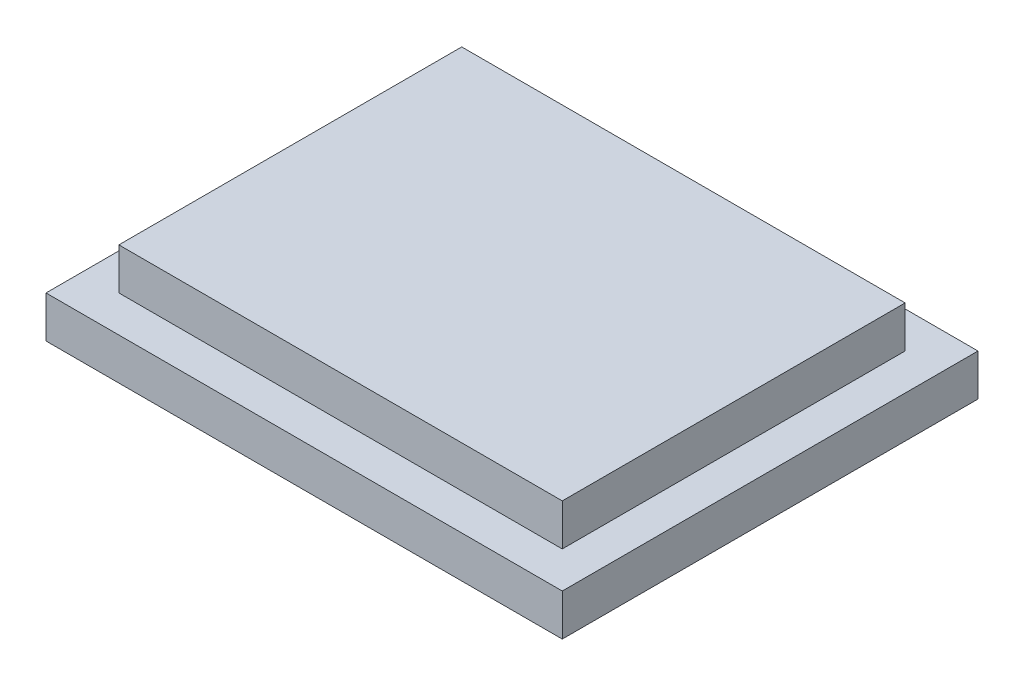
from build123d import *

# Parameters (mm, degrees)
SKETCH1_W           = 24.8
SKETCH1_H           = 19.97
BOSS_EXTRUDE1_DEPTH = 2
SKETCH2_W           = 21.3
SKETCH2_H           = 16.47
BOSS_EXTRUDE2_DEPTH = 2


with BuildPart() as part:
    # Sketch1 → Boss-Extrude1 (new body)
    with BuildSketch(Plane(origin=(0, 0, 0), x_dir=(1, 0, 0), z_dir=(0, 1, 0))):
        with Locations((12.4, 9.985)):
            Rectangle(SKETCH1_W, SKETCH1_H)
    extrude(amount=BOSS_EXTRUDE1_DEPTH)

    # Sketch2 → Boss-Extrude2 (add)
    with BuildSketch(Plane(origin=(0, 2, 0), x_dir=(1, 0, 0), z_dir=(0, 1, 0))):
        with Locations((12.4, 9.985)):
            Rectangle(SKETCH2_W, SKETCH2_H)
    extrude(amount=BOSS_EXTRUDE2_DEPTH)


solid = part.part
